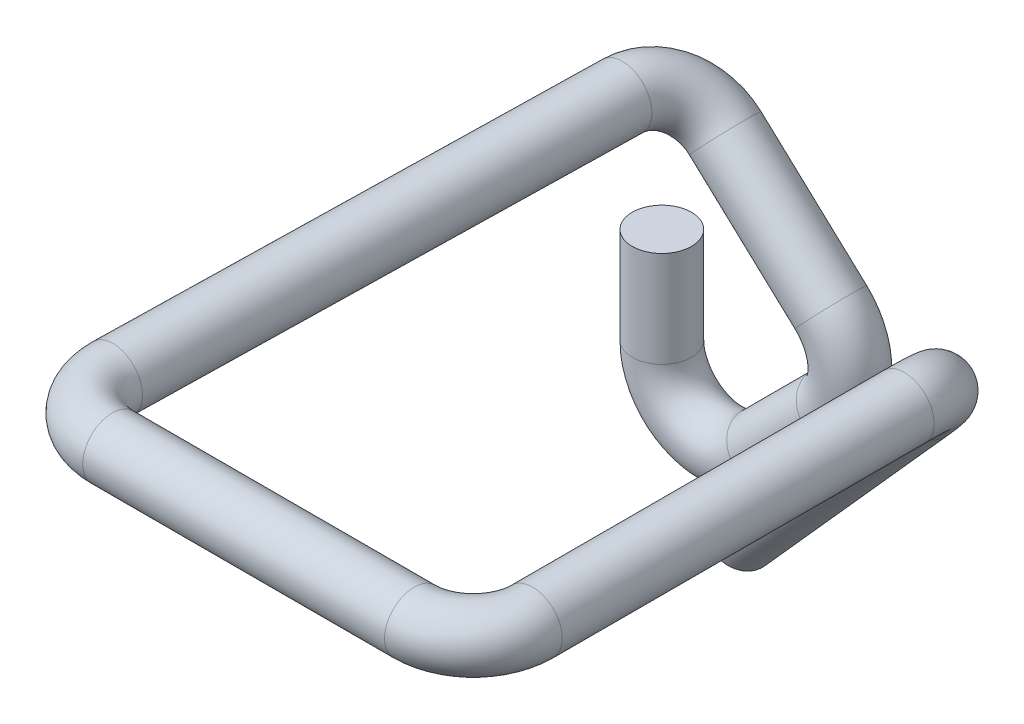
from build123d import *

# Parameters (mm, degrees)
SWEEP1_PROFILE_R = 6.35


with BuildPart() as part:
    # Sweep1: sweep along a curve in space
    with BuildLine() as sweep1_path:
        Line((0, 30.660512242, 0), (0, 51.251551799, 0))
        ThreePointArc((21.680256121, 21.680256121, 0), (7.839920409, 18.927242179, 0), (0, 30.660512242, 0))
        Line((21.680256121, 21.680256121, 0), (36.593044938, 36.593044938, 0))
        ThreePointArc((36.242775611, 54.890668065, 0), (40.310462498, 45.816371188, 0), (36.593044938, 36.593044938, 0))
        Line((13.595135631, 75.867499161, 0), (36.242775611, 54.890668065, 0))
        ThreePointArc((4.159082285, 84.367183458, 12.505555788), (7.022099563, 81.885473102, 3.65133177), (13.595135631, 75.867499161, 0))
        Line((4.159082285, 84.367183458, 12.505555788), (1.940115876, 84.367183458, 119.494337396))
        ThreePointArc((14.637385273, 84.367183458, 132.457681028), (5.564500833, 84.367183458, 128.64434339), (1.940115876, 84.367183458, 119.494337396))
        Line((14.637385273, 84.367183458, 132.457681028), (79.353045143, 84.367183458, 132.457681028))
        ThreePointArc((92.053045143, 84.367183458, 119.757681028), (88.333301264, 84.367183458, 128.737937149), (79.353045143, 84.367183458, 132.457681028))
        Line((92.053045143, 84.367183458, 119.757681028), (92.053045143, 84.367183458, 40.042301899))
        ThreePointArc((83.5860947, 74.901416178, 27.342301899), (89.573132774, 81.594724411, 31.062045778), (92.053045143, 84.367183458, 40.042301899))
        Line((44.216734329, 30.887788634, 27.342301899), (83.5860947, 74.901416178, 27.342301899))
    # Sweep1 profile (on start of the path) → Sweep1 (sweep)
    with BuildSketch(Plane(origin=(44.216734329, 30.887788634, 27.342301899), x_dir=(0.745336006287207, -0.6666890112577502, 0), z_dir=(0.6666890112577502, 0.745336006287207, 0))):
        Circle(SWEEP1_PROFILE_R)
    sweep(path=sweep1_path.line)


solid = part.part
